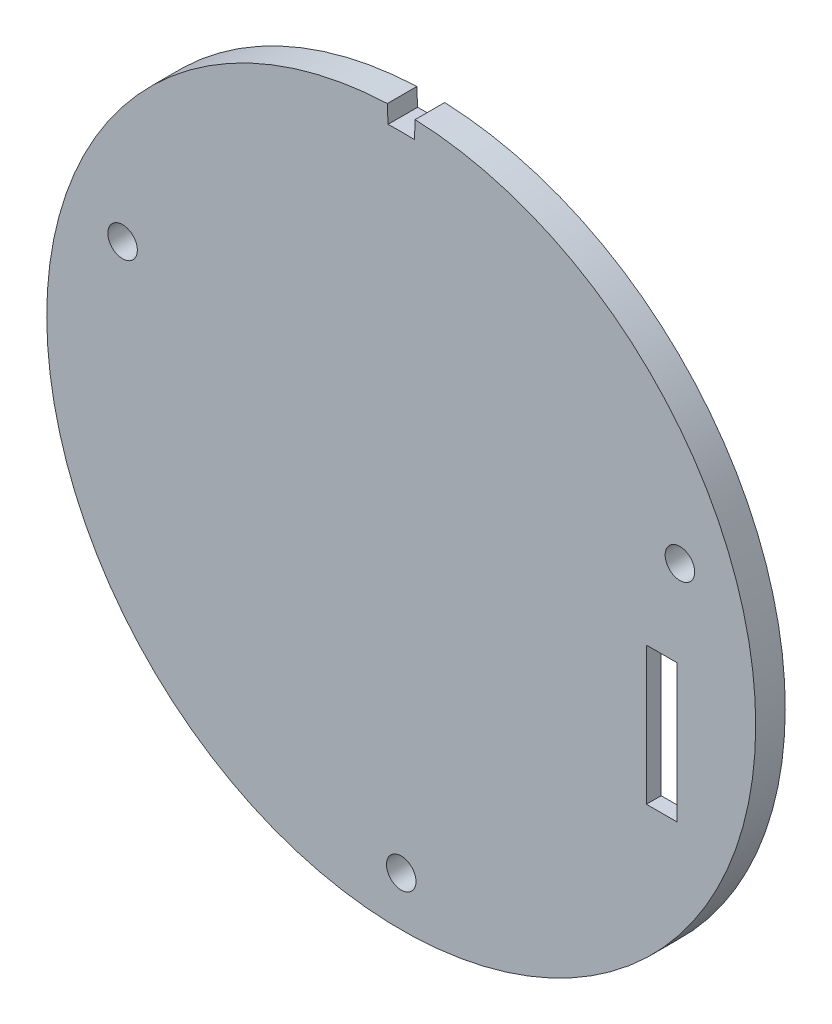
from build123d import *

# Parameters (mm, degrees)
SKETCH1_R           = 1.5
BOSS_EXTRUDE3_DEPTH = 3
BOSS_EXTRUDE4_DEPTH = 1.5


with BuildPart() as part:
    # Sketch1 → Boss-Extrude3 (new body)
    with BuildSketch(Plane.XY):
        with BuildLine():
            Line((-1.413353367, 35.972245305), (-1.342685699, 34.173633039))
            ThreePointArc((-1.342685699, 34.173633039), (0, 34.2), (1.342685699, 34.173633039))
            Line((1.342685699, 34.173633039), (1.413353367, 35.972245305))
            ThreePointArc((1.413353367, 35.972245305), (0, -36), (-1.413353367, 35.972245305))
        make_face()
        with Locations((28.3, 10.376069152)):
            Circle(SKETCH1_R, mode=Mode.SUBTRACT)
        with Locations((-28.3, 10.376069152)):
            Circle(SKETCH1_R, mode=Mode.SUBTRACT)
        with Locations((0, -31)):
            Circle(SKETCH1_R, mode=Mode.SUBTRACT)
        Polygon((-28, 4.5), (28, 4.5), (28, -17), (21.5, -23.5), (-21.5, -23.5), (-28, -17), align=None, mode=Mode.SUBTRACT)
    extrude(amount=-BOSS_EXTRUDE3_DEPTH)

    # Sketch1<9> → Boss-Extrude4 (add)
    with BuildSketch(Plane.XY):
        Polygon((28, 4.5), (0, 4.5), (0, -23.5), (21.5, -23.5), (28, -17), (28, -12.5), (24.9, -12.5), (24.9, 1.5), (28, 1.5), align=None)
        Polygon((0, -23.5), (0, 4.5), (-28, 4.5), (-28, -17), (-21.5, -23.5), align=None)
    extrude(amount=-BOSS_EXTRUDE4_DEPTH)


solid = part.part
